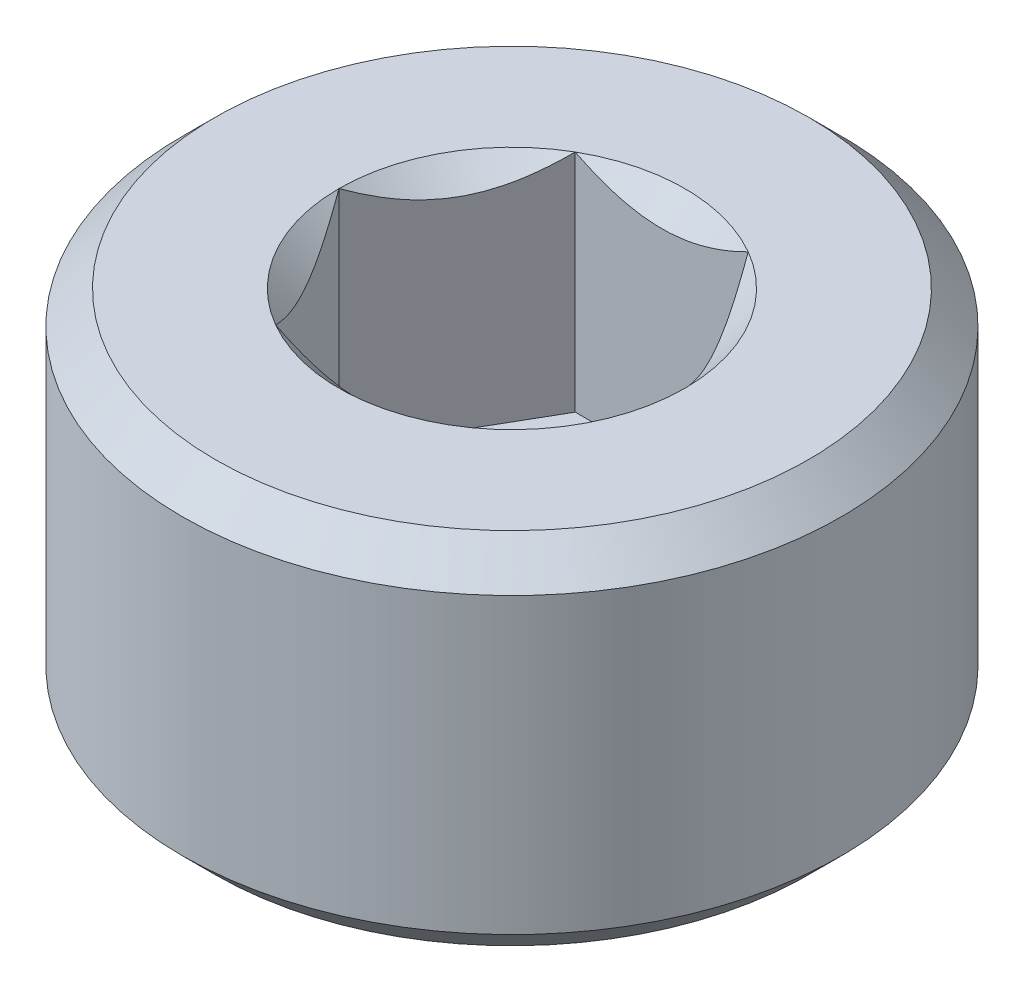
from build123d import *

# Parameters (mm, degrees)
SKETCH1_R           = 2.75
BOSS_EXTRUDE1_DEPTH = 3
CUT_EXTRUDE1_DEPTH  = 1.88
CHAMFER1_SIZE       = 0.275


with BuildPart() as part:
    # Sketch1 → Boss-Extrude1 (new body)
    with BuildSketch(Plane(origin=(0, 0, 0), x_dir=(1, 0, 0), z_dir=(0, 1, 0))):
        with Locations(Location((0, 0, 0), (0, 0, 270))):
            Circle(SKETCH1_R)
    extrude(amount=BOSS_EXTRUDE1_DEPTH)

    # Sketch2 → Cut-Extrude1 (cut)
    with BuildSketch(Plane(origin=(0, 3, 0), x_dir=(1, 0, 0), z_dir=(0, 1, 0))):
        Polygon((0.721687836, 1.25), (-0.721687836, 1.25), (-1.443375673, 0), (-0.721687836, -1.25), (0.721687836, -1.25), (1.443375673, 0), align=None)
    extrude(amount=-CUT_EXTRUDE1_DEPTH, mode=Mode.SUBTRACT)

    # Cut-Extrude2 cone 1 section (through the dimple's axis) → Cut-Extrude2 (revolve, cut)
    with BuildSketch(Plane(origin=(0, 3, 0), x_dir=(0, 0, 1), z_dir=(1, 0, 0))):
        Polygon((0, 0), (1.443375673, 0), (0, 1.443375673), align=None)
    revolve(axis=Axis((0, 3, 0), (0, -1, 0)), mode=Mode.SUBTRACT)

    # Chamfer1
    chamfer1_edges = [part.edges().sort_by_distance(p)[0] for p in [
        (0, 0, -2.75),
        (0, 3, -2.75),
    ]]
    chamfer(chamfer1_edges, length=CHAMFER1_SIZE)


solid = part.part
